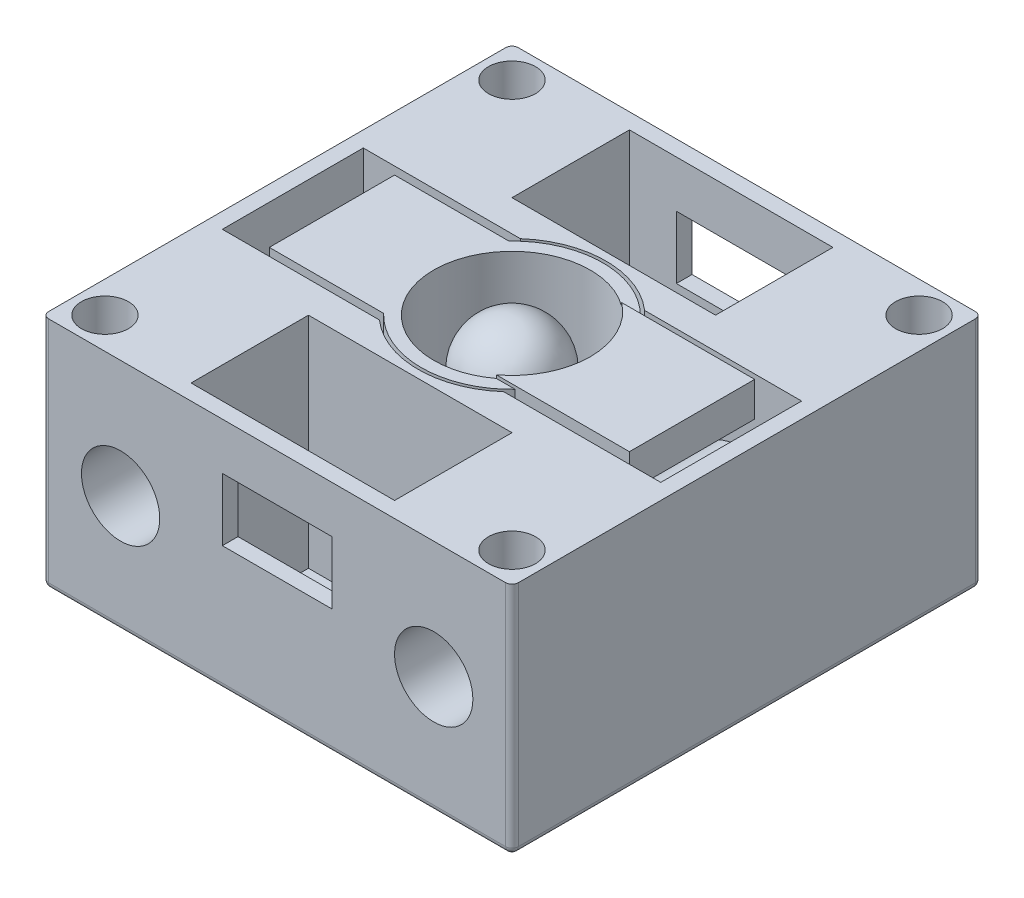
from build123d import *

# Parameters (mm, degrees)
SKETCH_2_W                      = 15
SKETCH_2_H                      = 15
EXTRUDE_1_DEPTH                 = 7.5
SKETCH_3_W                      = 14
SKETCH_3_H                      = 4.5
CUT_EXTRUDE_1_DEPTH             = 7
SKETCH_4_R                      = 3
CUT_EXTRUDE_2_DEPTH             = 4.5
SKETCH_5_W                      = 6.5
SKETCH_5_H                      = 3.75
CUT_EXTRUDE_3_DEPTH             = 7
EXTRUDE_2_REACH                 = 20.371
SKETCH_6_R                      = 1.5
SKETCH_7_R                      = 1.25
CUT_EXTRUDE_4_DEPTH             = 19.371173071
SKETCH_8_W                      = 3
SKETCH_8_H                      = 3
EXTRUDE_3_DEPTH                 = 1
CUT_EXTRUDE_5_REACH             = 20.371
SKETCH_9_W                      = 3.5
SKETCH_9_H                      = 2
CUT_EXTRUDE_6_REACH             = 35.371
CUT_EXTRUDE_START               = -15
SKETCH_9_2_W                    = 3.5
SKETCH_9_2_H                    = 2
EXTRUDE_4_DEPTH                 = 2
EXTRUDE_4_DEPTH_BACK            = 2
CUT_EXTRUDE_7_REACH             = 14.99
CUT_EXTRUDE_7_DIRECTION_2_REACH = 14.99
FILLET_1_R                      = 0.1
FILLET_2_R                      = 0.2
SKETCH_12_R                     = 0.75
CUT_EXTRUDE_8_DEPTH             = 2
SKETCH_13_W                     = 11.5
SKETCH_13_H                     = 4
EXTRUDE_5_DEPTH                 = 1
SKETCH_14_R                     = 2.9
EXTRUDE_6_DEPTH                 = 4
SKETCH_15_R                     = 2.5
CUT_EXTRUDE_9_DEPTH             = 3.5
EXTRUDE_7_DEPTH                 = 0.1


with BuildPart() as part:
    # 草图2 → 凸台-拉伸1 (new body)
    with BuildSketch(Plane(origin=(0, 0, 0), x_dir=(1, 0, 0), z_dir=(0, 1, 0))):
        Rectangle(SKETCH_2_W, SKETCH_2_H)
    extrude(amount=EXTRUDE_1_DEPTH)

    # 草图3 → 切除-拉伸1 (cut)
    with BuildSketch(Plane(origin=(0, 7.5, 0), x_dir=(-1, 0, 0), z_dir=(0, 1, 0))):
        Rectangle(SKETCH_3_W, SKETCH_3_H)
    extrude(amount=-CUT_EXTRUDE_1_DEPTH, mode=Mode.SUBTRACT)

    # 草图4 → 切除-拉伸2 (cut)
    with BuildSketch(Plane(origin=(0, 7.5, 0), x_dir=(1, 0, 0), z_dir=(0, 1, 0))):
        Circle(SKETCH_4_R)
    extrude(amount=-CUT_EXTRUDE_2_DEPTH, mode=Mode.SUBTRACT)

    # 草图5 → 切除-拉伸3 (cut)
    with BuildSketch(Plane(origin=(0, 7.5, 0), x_dir=(-1, 0, 0), z_dir=(0, 1, 0))):
        with Locations((0, -5.125)):
            Rectangle(SKETCH_5_W, SKETCH_5_H)
        with Locations((0, 5.125)):
            Rectangle(SKETCH_5_W, SKETCH_5_H)
    extrude(amount=-CUT_EXTRUDE_3_DEPTH, mode=Mode.SUBTRACT)

    # 草图6 → 凸台-拉伸2 (add, up to next)
    with BuildSketch(Plane.XY.offset(7.5), mode=Mode.PRIVATE) as extrude_2_sk1:
        with Locations((-5, 3.75)):
            Circle(SKETCH_6_R)
    extrude_2_tool1 = extrude(extrude_2_sk1.sketch, amount=-EXTRUDE_2_REACH, mode=Mode.PRIVATE) - part.part
    # 草图6 → 凸台-拉伸2 (add, up to next)
    with BuildSketch(Plane.XY.offset(7.5), mode=Mode.PRIVATE) as extrude_2_sk2:
        with Locations((5, 3.75)):
            Circle(SKETCH_6_R)
    extrude_2_tool2 = extrude(extrude_2_sk2.sketch, amount=-EXTRUDE_2_REACH, mode=Mode.PRIVATE) - part.part
    add(extrude_2_tool1.solids().sort_by_distance((-5, 3.75, 7.5))[0])
    add(extrude_2_tool2.solids().sort_by_distance((5, 3.75, 7.5))[0])

    # 草图7 → 切除-拉伸4 (cut, through all)
    with BuildSketch(Plane.XY.offset(7.5)):
        with Locations((-5, 3.75)):
            Circle(SKETCH_7_R)
        with Locations((5, 3.75)):
            Circle(SKETCH_7_R)
    extrude(amount=-CUT_EXTRUDE_4_DEPTH, mode=Mode.SUBTRACT)

    # 草图8 → 凸台-拉伸3 (add)
    with BuildSketch(Plane.XZ):
        Rectangle(SKETCH_8_W, SKETCH_8_H)
    extrude(amount=EXTRUDE_3_DEPTH)

    # 草图9 → 切除-拉伸5 (cut, up to next)
    with BuildSketch(Plane.XY.offset(7.5), mode=Mode.PRIVATE) as cut_extrude_5_sk1:
        with Locations((0, 5)):
            Rectangle(SKETCH_9_W, SKETCH_9_H)
    cut_extrude_5_tool1 = extrude(cut_extrude_5_sk1.sketch, amount=-CUT_EXTRUDE_5_REACH, mode=Mode.PRIVATE) & part.part
    add(cut_extrude_5_tool1.solids().sort_by_distance((0, 5, 7.5))[0], mode=Mode.SUBTRACT)

    # 草图9<2> → 切除-拉伸6 (cut, up to next)
    with BuildSketch(Plane.XY.offset(7.5).offset(CUT_EXTRUDE_START), mode=Mode.PRIVATE) as cut_extrude_6_sk1:
        with Locations((0, 5)):
            Rectangle(SKETCH_9_2_W, SKETCH_9_2_H)
    cut_extrude_6_tool1 = extrude(cut_extrude_6_sk1.sketch, amount=CUT_EXTRUDE_6_REACH, mode=Mode.PRIVATE) & part.part
    add(cut_extrude_6_tool1.solids().sort_by_distance((0, 5, -7.5))[0], mode=Mode.SUBTRACT)

    # 草图10 → 凸台-拉伸4 (add, two sides: drawn at the far end of the back side and taken through both)
    with BuildSketch(Plane.XY.offset(-EXTRUDE_4_DEPTH_BACK)):
        with BuildLine():
            Line((-1.95, -2.5), (1.95, -2.5))
            Line((1.95, -2.5), (1.95, -1.555590279))
            ThreePointArc((1.95, -1.555590279), (1.780042303, -1.088161527), (1.5, -0.677124344))
            Line((1.5, -0.677124344), (-1.5, -0.677124344))
            ThreePointArc((-1.5, -0.677124344), (-1.780042303, -1.088161527), (-1.95, -1.555590279))
            Line((-1.95, -1.555590279), (-1.95, -2.5))
        make_face()
    extrude(amount=EXTRUDE_4_DEPTH + EXTRUDE_4_DEPTH_BACK)

    # 草图11 → 切除-拉伸7 (cut, up to next)
    with BuildSketch(Plane(origin=(0, 0, 0), x_dir=(0, 0, -1), z_dir=(1, 0, 0)), mode=Mode.PRIVATE) as cut_extrude_7_sk1:
        with BuildLine():
            Line((1.95, -2.5), (1.95, -1.555590279))
            ThreePointArc((1.95, -1.555590279), (1.780042303, -1.088161527), (1.5, -0.677124344))
            Line((1.5, -0.677124344), (2, -0.677124344))
            Line((2, -0.677124344), (2, -2.5))
            Line((2, -2.5), (1.95, -2.5))
        make_face()
    cut_extrude_7_tool1 = extrude(cut_extrude_7_sk1.sketch, amount=-CUT_EXTRUDE_7_REACH, mode=Mode.PRIVATE) & part.part
    # 草图11 → 切除-拉伸7 (cut, up to next)
    with BuildSketch(Plane(origin=(0, 0, 0), x_dir=(0, 0, -1), z_dir=(1, 0, 0)), mode=Mode.PRIVATE) as cut_extrude_7_sk2:
        with BuildLine():
            Line((-1.95, -2.5), (-1.95, -1.555590279))
            ThreePointArc((-1.95, -1.555590279), (-1.780042303, -1.088161527), (-1.5, -0.677124344))
            Line((-1.5, -0.677124344), (-2, -0.677124344))
            Line((-2, -0.677124344), (-2, -2.5))
            Line((-2, -2.5), (-1.95, -2.5))
        make_face()
    cut_extrude_7_tool2 = extrude(cut_extrude_7_sk2.sketch, amount=-CUT_EXTRUDE_7_REACH, mode=Mode.PRIVATE) & part.part
    add(cut_extrude_7_tool1.solids().sort_by_distance((0, -1.175075, -1.873038))[0], mode=Mode.SUBTRACT)
    add(cut_extrude_7_tool2.solids().sort_by_distance((0, -1.175075, 1.873038))[0], mode=Mode.SUBTRACT)

    # 草图11 → 切除-拉伸7 direction 2 (cut, up to next)
    with BuildSketch(Plane(origin=(0, 0, 0), x_dir=(0, 0, -1), z_dir=(1, 0, 0)), mode=Mode.PRIVATE) as cut_extrude_7_direction_2_sk1:
        with BuildLine():
            Line((1.95, -2.5), (1.95, -1.555590279))
            ThreePointArc((1.95, -1.555590279), (1.780042303, -1.088161527), (1.5, -0.677124344))
            Line((1.5, -0.677124344), (2, -0.677124344))
            Line((2, -0.677124344), (2, -2.5))
            Line((2, -2.5), (1.95, -2.5))
        make_face()
    cut_extrude_7_direction_2_tool1 = extrude(cut_extrude_7_direction_2_sk1.sketch, amount=CUT_EXTRUDE_7_DIRECTION_2_REACH, mode=Mode.PRIVATE) & part.part
    # 草图11 → 切除-拉伸7 direction 2 (cut, up to next)
    with BuildSketch(Plane(origin=(0, 0, 0), x_dir=(0, 0, -1), z_dir=(1, 0, 0)), mode=Mode.PRIVATE) as cut_extrude_7_direction_2_sk2:
        with BuildLine():
            Line((-1.95, -2.5), (-1.95, -1.555590279))
            ThreePointArc((-1.95, -1.555590279), (-1.780042303, -1.088161527), (-1.5, -0.677124344))
            Line((-1.5, -0.677124344), (-2, -0.677124344))
            Line((-2, -0.677124344), (-2, -2.5))
            Line((-2, -2.5), (-1.95, -2.5))
        make_face()
    cut_extrude_7_direction_2_tool2 = extrude(cut_extrude_7_direction_2_sk2.sketch, amount=CUT_EXTRUDE_7_DIRECTION_2_REACH, mode=Mode.PRIVATE) & part.part
    add(cut_extrude_7_direction_2_tool1.solids().sort_by_distance((0, -1.175075, -1.873038))[0], mode=Mode.SUBTRACT)
    add(cut_extrude_7_direction_2_tool2.solids().sort_by_distance((0, -1.175075, 1.873038))[0], mode=Mode.SUBTRACT)

    # 圆角1
    fillet_1_edges = [part.edges().sort_by_distance(p)[0] for p in [
        (-1.95, -2.5, 0),
        (1.95, -2.5, 0),
        (0, -2.5, -1.95),
        (0, -2.5, 1.95),
    ]]
    fillet(fillet_1_edges, radius=FILLET_1_R)

    # 圆角2
    fillet_2_edges = [part.edges().sort_by_distance(p)[0] for p in [
        (0, 0, -7.5),
        (7.5, 0, 0),
        (0, 0, 7.5),
        (-7.5, 0, 0),
        (-7.5, 3.75, -7.5),
        (7.5, 3.75, -7.5),
        (7.5, 3.75, 7.5),
        (-7.5, 3.75, 7.5),
    ]]
    fillet(fillet_2_edges, radius=FILLET_2_R)

    # 草图12 → 切除-拉伸8 (cut)
    with BuildSketch(Plane(origin=(0, 7.5, 0), x_dir=(-1, 0, 0), z_dir=(0, 1, 0))):
        with Locations(Location((6.5, -6.5, 0), (0, 0, 90))):
            Circle(SKETCH_12_R)
        with Locations(Location((-6.5, 6.5, 0), (0, 0, 90))):
            Circle(SKETCH_12_R)
        with Locations(Location((6.5, 6.5, 0), (0, 0, 90))):
            Circle(SKETCH_12_R)
        with Locations(Location((-6.5, -6.5, 0), (0, 0, 90))):
            Circle(SKETCH_12_R)
    extrude(amount=-CUT_EXTRUDE_8_DEPTH, mode=Mode.SUBTRACT)


with BuildPart() as body_2:
    # 草图13 → 凸台-拉伸5 (new body)
    with BuildSketch(Plane(origin=(0, 7.5, 0), x_dir=(-1, 0, 0), z_dir=(0, 1, 0))):
        Rectangle(SKETCH_13_W, SKETCH_13_H)
    extrude(amount=-EXTRUDE_5_DEPTH)

    # 草图14 → 凸台-拉伸6 (add)
    with BuildSketch(Plane(origin=(0, 7.5, 0), x_dir=(-1, 0, 0), z_dir=(0, 1, 0))):
        with Locations(Location((0, 0, 0), (0, 0, 90))):
            Circle(SKETCH_14_R)
    extrude(amount=-EXTRUDE_6_DEPTH)

    # 草图15 → 切除-拉伸9 (cut)
    with BuildSketch(Plane(origin=(0, 7.5, 0), x_dir=(-1, 0, 0), z_dir=(0, 1, 0))):
        with Locations(Location((0, 0, 0), (0, 0, 90))):
            Circle(SKETCH_15_R)
    extrude(amount=-CUT_EXTRUDE_9_DEPTH, mode=Mode.SUBTRACT)

    # 草图16 → 旋转2 (revolve)
    with BuildSketch(Plane.XY):
        with BuildLine():
            Line((1.5, 4), (1.5, 6.000567678))
            ThreePointArc((1.5, 6.000567678), (1.060660172, 7.060660172), (0, 7.5))
            Line((0, 7.5), (0, 4))
            Line((0, 4), (1.5, 4))
        make_face()
    revolve(axis=Axis((0, -0.447775082, 0), (0, 1, 0)))

    # 草图17 → 凸台-拉伸7 (add)
    with BuildSketch(Plane(origin=(0, 7.5, 0), x_dir=(-1, 0, 0), z_dir=(0, 1, 0))):
        with BuildLine():
            Line((-5.75, 2), (-1.5, 2))
            ThreePointArc((-1.5, 2), (-2.5, 0), (-1.5, -2))
            Line((-1.5, -2), (-5.75, -2))
            Line((-5.75, -2), (-5.75, 2))
        make_face()
    extrude(amount=EXTRUDE_7_DEPTH)


solid = Compound([part.part, body_2.part])
